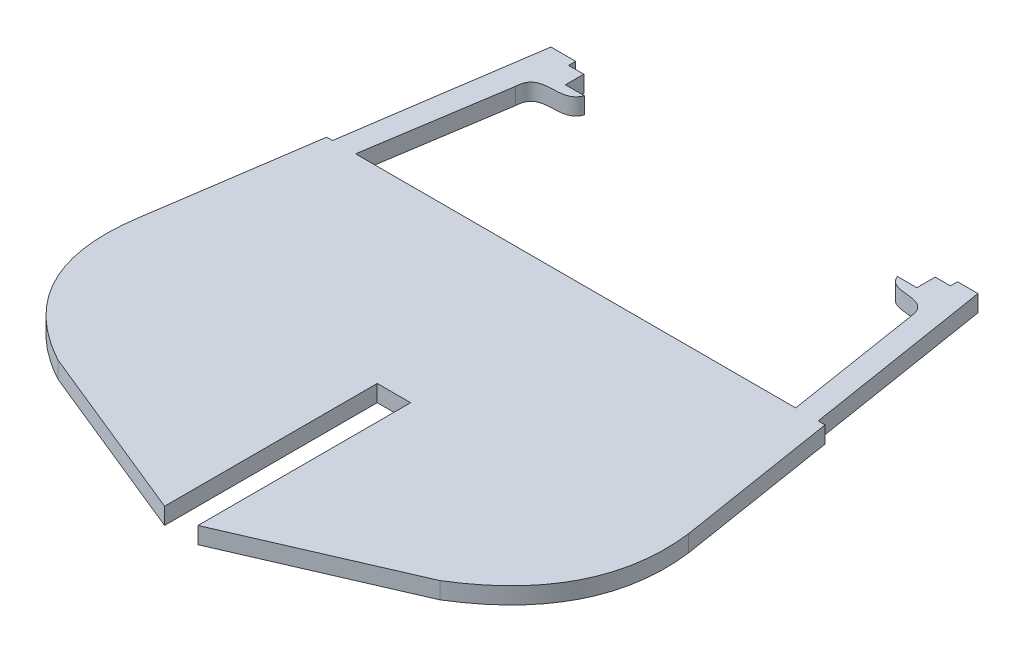
from build123d import *

# Parameters (mm, degrees)
EXTRUDE_1_DEPTH = 4


with BuildPart() as part:
    # 草图1 → 凸台-拉伸1 (new body)
    with BuildSketch(Plane(origin=(0, 0, 0), x_dir=(1, 0, 0), z_dir=(0, 1, 0))):
        with BuildLine():
            Line((-171.971094603, -45.598997709), (-166.188191845, -6.627261728))
            Line((-166.188191845, -6.627261728), (-164.805323794, -6.627261728))
            Line((-164.805323794, -6.627261728), (-158.040783066, 38.959860567))
            Line((-158.040783066, 38.959860567), (-152.108080781, 38.959860567))
            Line((-152.108080781, 38.959860567), (-152.108080781, 37.24737007))
            Line((-152.108080781, 37.24737007), (-148.462337738, 37.24737007))
            Line((-148.462337738, 37.24737007), (-148.462337738, 32.847335362))
            Line((-148.462337738, 32.847335362), (-143.936587753, 32.847335362))
            add(Edge.make_bspline(
                [(-143.936587753, 32.847335362), (-145.689971567, 27.988679884), (-153.862596813, 33.234755139), (-154.119525219, 26.561571494)],
                knots=[0, 0, 0, 0, 1, 1, 1, 1], degree=3))
            Line((-154.119525219, 26.561571494), (-159.27385159, -6.627261728))
            Line((-159.27385159, -6.627261728), (-53.798733888, -6.627261728))
            Line((-53.798733888, -6.627261728), (-59.078775537, 26.561571494))
            add(Edge.make_bspline(
                [(-68.884567171, 32.847335362), (-67.18347063, 28.238626072), (-59.875334598, 32.556519598), (-59.078775537, 26.561571494)],
                knots=[0, 0, 0, 0, 1, 1, 1, 1], degree=3))
            Line((-68.884567171, 32.847335362), (-64.233101908, 32.847335362))
            Line((-64.233101908, 32.847335362), (-64.233101908, 37.24737007))
            Line((-64.233101908, 37.24737007), (-60.587358865, 37.24737007))
            Line((-60.587358865, 37.24737007), (-60.587358865, 38.959860567))
            Line((-60.587358865, 38.959860567), (-55.684463048, 38.959860567))
            Line((-55.684463048, 38.959860567), (-48.392976961, -6.627261728))
            Line((-48.392976961, -6.627261728), (-46.758678356, -6.627261728))
            Line((-46.758678356, -6.627261728), (-40.525298042, -45.598997709))
            add(Edge.make_bspline(
                [(-40.525298042, -45.598997709), (-37.332682932, -70.815101754), (-60.587358865, -85.098918409)],
                knots=[0, 0, 0, 1, 1, 1], degree=2))
            Line((-60.587358865, -85.098918409), (-101.024567621, -102.65158724))
            Line((-101.024567621, -102.65158724), (-101.024567621, -51.689651756))
            Line((-101.024567621, -51.689651756), (-109.024567621, -51.689651756))
            Line((-109.024567621, -51.689651756), (-109.024567621, -102.65158724))
            Line((-109.024567621, -102.65158724), (-152.108080781, -85.098918409))
            add(Edge.make_bspline(
                [(-171.971094603, -45.598997709), (-176.165938526, -72.054975501), (-152.108080781, -85.098918409)],
                knots=[0, 0, 0, 1, 1, 1], degree=2))
        make_face()
    extrude(amount=EXTRUDE_1_DEPTH)


solid = part.part
